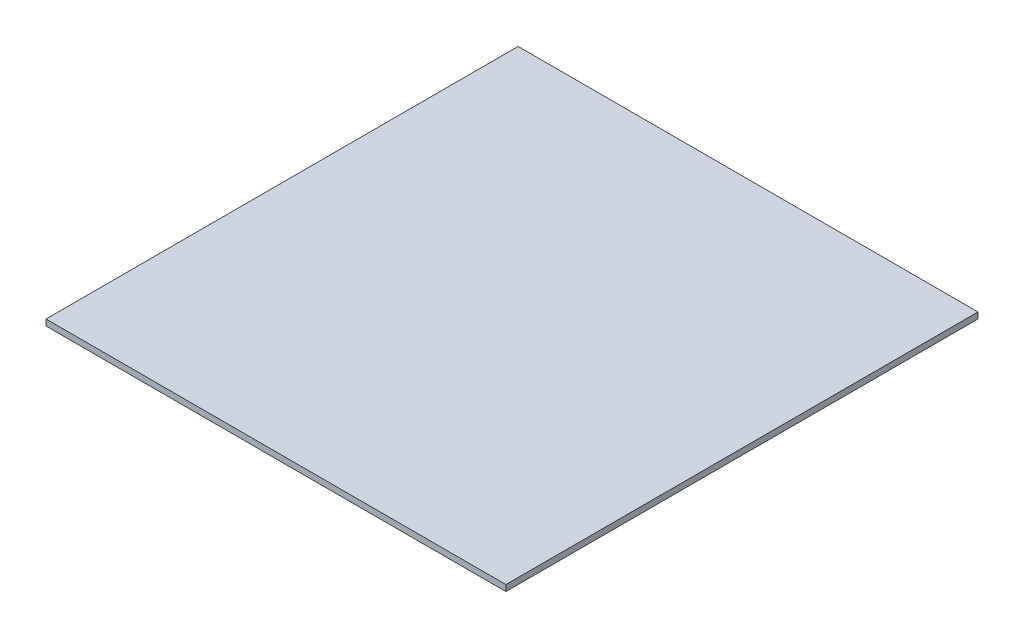
from build123d import *

# Parameters (mm, degrees)
SKETCH1_W           = 150.7
SKETCH1_H           = 154.7
BOSS_EXTRUDE1_DEPTH = 2


with BuildPart() as part:
    # Sketch1 → Boss-Extrude1 (new body)
    with BuildSketch(Plane(origin=(0, 0, 0), x_dir=(1, 0, 0), z_dir=(0, 1, 0))):
        Rectangle(SKETCH1_W, SKETCH1_H)
    extrude(amount=BOSS_EXTRUDE1_DEPTH)


solid = part.part
